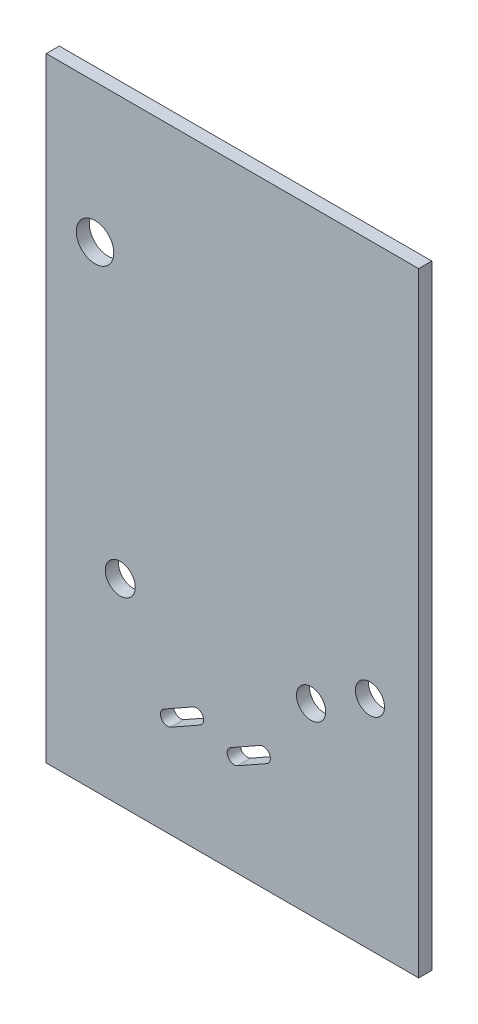
from build123d import *

# Parameters (mm, degrees)
SKETCH1_R           = 3.6
SKETCH1_R_2         = 3.5
SKETCH1_R_3         = 4.5
BOSS_EXTRUDE1_DEPTH = 3.14


with BuildPart() as part:
    # Sketch1 → Boss-Extrude1 (new body)
    # profile 1 of 10: a face of its own
    with BuildSketch(Plane.XY):
        with BuildLine():
            Line((38.651827519, 73.647136153), (-26.230787773, 73.647136153))
            Line((-26.230787773, 73.647136153), (-41.648963672, 73.647136153))
            add(Edge.make_bspline(
                [(-41.648963672, 73.647136153), (-44.643488897, 73.643488897), (-44.647136153, 70.648963672)],
                knots=[3.927599805, 3.927599805, 3.927599805, 5.497178156, 5.497178156, 5.497178156], degree=2, weights=[1, 0.707537269, 1]))
            Line((-44.647136153, 70.648963672), (-44.647136153, -70.648963672))
            add(Edge.make_bspline(
                [(-44.647136153, -70.648963672), (-44.643488897, -73.643488897), (-41.648963672, -73.647136153)],
                knots=[3.927599805, 3.927599805, 3.927599805, 5.497178156, 5.497178156, 5.497178156], degree=2, weights=[1, 0.707537269, 1]))
            Line((-41.648963672, -73.647136153), (27.093393639, -73.647136153))
            add(Edge.make_bspline(
                [(44.647136153, -54.550700861), (44.629350083, -55.622608831), (44.523578432, -56.687840097), (44.215717336, -58.366181711), (44.071515423, -58.983678353), (43.719242041, -60.213836545), (43.51280516, -60.820227412), (42.807525079, -62.600781834), (42.22206304, -63.742215888), (41.337337041, -65.108539745), (41.152542037, -65.37883334), (40.771685792, -65.906986664), (40.57512321, -66.165654002), (39.967232089, -66.92560473), (39.108255703, -67.89614606), (38.152323748, -68.781197278), (37.146406736, -69.622175477), (36.615243643, -70.022491506), (34.981146078, -71.128530207), (33.83112161, -71.747972893), (32.318701378, -72.376617626), (32.012437216, -72.49499434), (31.392225647, -72.716804064), (31.077608459, -72.820394039), (30.133341911, -73.105042114), (29.500121034, -73.261325902), (28.276366882, -73.499851982), (27.686391293, -73.587126278), (27.093393639, -73.647136153)],
                knots=[0.018260035, 0.018260035, 0.018260035, 0.018260035, 0.125, 0.125, 0.1875, 0.1875, 0.25, 0.25, 0.375, 0.375, 0.40625, 0.40625, 0.4375, 0.4375, 0.5, 0.5625, 0.5625, 0.625, 0.625, 0.75, 0.75, 0.78125, 0.78125, 0.8125, 0.8125, 0.875, 0.875, 0.932610516, 0.932610516, 0.932610516, 0.932610516], degree=3))
            Line((44.647136153, -54.550700861), (44.647136153, -53.896039233))
            Line((44.647136153, -53.896039233), (44.647136153, 22.020325098))
            ThreePointArc((44.647136153, 22.020325098), (42.730516554, 17.699527097), (39.139308268, 14.626100819))
            Line((39.139308268, 14.626100819), (39.139308268, 13.683084381))
            ThreePointArc((39.139308268, 13.683084381), (36.430045993, 7.142346655), (29.889308268, 4.433084381))
            Line((29.889308268, 4.433084381), (-36.027217939, 4.433084381))
            ThreePointArc((-36.027217939, 4.433084381), (-37.794984892, 5.165317428), (-38.527217939, 6.933084381))
            Line((-38.527217939, 6.933084381), (-38.527217939, 60.005147218))
            ThreePointArc((-38.527217939, 60.005147218), (-37.794984892, 61.772914171), (-36.027217939, 62.505147218))
            Line((-36.027217939, 62.505147218), (36.639308268, 62.505147218))
            ThreePointArc((36.639308268, 62.505147218), (38.40707522, 61.772914171), (39.139308268, 60.005147218))
            Line((39.139308268, 60.005147218), (39.139308268, 33.556674407))
            ThreePointArc((39.139308268, 33.556674407), (42.730516554, 30.483248128), (44.647136153, 26.162450128))
            Line((44.647136153, 26.162450128), (44.647136153, 67.670503394))
            Line((44.647136153, 67.670503394), (44.647136153, 70.648963672))
            add(Edge.make_bspline(
                [(44.647136153, 70.648963672), (44.643488897, 73.643488897), (41.648963672, 73.647136153)],
                knots=[3.927599805, 3.927599805, 3.927599805, 5.497178156, 5.497178156, 5.497178156], degree=2, weights=[1, 0.707537269, 1]))
            Line((41.648963672, 73.647136153), (38.651827519, 73.647136153))
        make_face()
        with BuildLine():
            ThreePointArc((-14.745996033, -51.265124074), (-17.044884469, -50.621435312), (-16.401195707, -48.322546875))
            Line((-16.401195707, -48.322546875), (-9.42859141, -44.400456958))
            ThreePointArc((-9.42859141, -44.400456958), (-7.129702973, -45.04414572), (-7.773391736, -47.343034157))
            Line((-7.773391736, -47.343034157), (-14.745996033, -51.265124074))
        make_face(mode=Mode.SUBTRACT)
        with Locations((-26.900831216, -26.517202566)):
            Circle(SKETCH1_R, mode=Mode.SUBTRACT)
        with BuildLine():
            ThreePointArc((1.254003967, -51.265124074), (-1.044884469, -50.621435312), (-0.401195707, -48.322546875))
            Line((-0.401195707, -48.322546875), (6.57140859, -44.400456958))
            ThreePointArc((6.57140859, -44.400456958), (8.870297027, -45.04414572), (8.226608264, -47.343034157))
            Line((8.226608264, -47.343034157), (1.254003967, -51.265124074))
        make_face(mode=Mode.SUBTRACT)
        with Locations((18.849494268, -29.546234455)):
            Circle(SKETCH1_R_2, mode=Mode.SUBTRACT)
        with Locations((32.960239, -21.476652312)):
            Circle(SKETCH1_R_2, mode=Mode.SUBTRACT)
    # profile 2 of 10: a face of its own
    with BuildSketch(Plane.XY):
        with BuildLine():
            add(Edge.make_bspline(
                [(-41.648963672, 73.647136153), (-44.643488897, 73.643488897), (-44.647136153, 70.648963672)],
                knots=[3.927599805, 3.927599805, 3.927599805, 5.497178156, 5.497178156, 5.497178156], degree=2, weights=[1, 0.707537269, 1]))
            Line((-41.648963672, 73.647136153), (-44.647136153, 73.647136153))
            Line((-44.647136153, 73.647136153), (-44.647136153, 70.648963672))
        make_face()
    # profile 3 of 10: a face of its own
    with BuildSketch(Plane.XY):
        with BuildLine():
            Line((44.647136153, 73.647136153), (41.648963672, 73.647136153))
            add(Edge.make_bspline(
                [(44.647136153, 70.648963672), (44.643488897, 73.643488897), (41.648963672, 73.647136153)],
                knots=[3.927599805, 3.927599805, 3.927599805, 5.497178156, 5.497178156, 5.497178156], degree=2, weights=[1, 0.707537269, 1]))
            Line((44.647136153, 70.648963672), (44.647136153, 73.647136153))
        make_face()
    # profile 4 of 10: a face of its own
    with BuildSketch(Plane.XY):
        with BuildLine():
            add(Edge.make_bspline(
                [(-44.647136153, -70.648963672), (-44.643488897, -73.643488897), (-41.648963672, -73.647136153)],
                knots=[3.927599805, 3.927599805, 3.927599805, 5.497178156, 5.497178156, 5.497178156], degree=2, weights=[1, 0.707537269, 1]))
            Line((-44.647136153, -70.648963672), (-44.647136153, -73.647136153))
            Line((-44.647136153, -73.647136153), (-41.648963672, -73.647136153))
        make_face()
    # profile 5 of 10: a face of its own
    with BuildSketch(Plane.XY):
        with BuildLine():
            Line((44.647136153, 22.020325098), (44.647136153, 26.162450128))
            ThreePointArc((44.647136153, 26.162450128), (42.730516554, 30.483248128), (39.139308268, 33.556674407))
            Line((39.139308268, 33.556674407), (39.139308268, 14.626100819))
            ThreePointArc((39.139308268, 14.626100819), (42.730516554, 17.699527097), (44.647136153, 22.020325098))
        make_face()
    # profile 6 of 10: a face of its own
    with BuildSketch(Plane.XY):
        with BuildLine():
            add(Edge.make_bspline(
                [(44.647136153, -54.550700861), (44.629350083, -55.622608831), (44.523578432, -56.687840097), (44.215717336, -58.366181711), (44.071515423, -58.983678353), (43.719242041, -60.213836545), (43.51280516, -60.820227412), (42.807525079, -62.600781834), (42.22206304, -63.742215888), (41.337337041, -65.108539745), (41.152542037, -65.37883334), (40.771685792, -65.906986664), (40.57512321, -66.165654002), (39.967232089, -66.92560473), (39.108255703, -67.89614606), (38.152323748, -68.781197278), (37.146406736, -69.622175477), (36.615243643, -70.022491506), (34.981146078, -71.128530207), (33.83112161, -71.747972893), (32.318701378, -72.376617626), (32.012437216, -72.49499434), (31.392225647, -72.716804064), (31.077608459, -72.820394039), (30.133341911, -73.105042114), (29.500121034, -73.261325902), (28.276366882, -73.499851982), (27.686391293, -73.587126278), (27.093393639, -73.647136153)],
                knots=[0.018260035, 0.018260035, 0.018260035, 0.018260035, 0.125, 0.125, 0.1875, 0.1875, 0.25, 0.25, 0.375, 0.375, 0.40625, 0.40625, 0.4375, 0.4375, 0.5, 0.5625, 0.5625, 0.625, 0.625, 0.75, 0.75, 0.78125, 0.78125, 0.8125, 0.8125, 0.875, 0.875, 0.932610516, 0.932610516, 0.932610516, 0.932610516], degree=3))
            Line((27.093393639, -73.647136153), (44.647136153, -73.647136153))
            Line((44.647136153, -73.647136153), (44.647136153, -54.550700861))
        make_face()
    # profile 7 of 10: a face of its own
    with BuildSketch(Plane.XY):
        with BuildLine():
            ThreePointArc((24.922228065, 29.508743732), (31.21939997, 34.382384037), (39.139308268, 33.556674407))
            Line((39.139308268, 33.556674407), (39.139308268, 60.005147218))
            ThreePointArc((39.139308268, 60.005147218), (38.40707522, 61.772914171), (36.639308268, 62.505147218))
            Line((36.639308268, 62.505147218), (-36.027217939, 62.505147218))
            ThreePointArc((-36.027217939, 62.505147218), (-37.794984892, 61.772914171), (-38.527217939, 60.005147218))
            Line((-38.527217939, 60.005147218), (-38.527217939, 6.933084381))
            ThreePointArc((-38.527217939, 6.933084381), (-37.794984892, 5.165317428), (-36.027217939, 4.433084381))
            Line((-36.027217939, 4.433084381), (29.889308268, 4.433084381))
            ThreePointArc((29.889308268, 4.433084381), (36.430045993, 7.142346655), (39.139308268, 13.683084381))
            Line((39.139308268, 13.683084381), (39.139308268, 14.626100819))
            ThreePointArc((39.139308268, 14.626100819), (31.21939997, 13.800391189), (24.922228065, 18.674031494))
            Line((24.922228065, 18.674031494), (24.922228065, 10.28797778))
            Line((24.922228065, 10.28797778), (-25.167870173, 10.28797778))
            Line((-25.167870173, 10.28797778), (-25.167870173, 56.21628744))
            Line((-25.167870173, 56.21628744), (24.922228065, 56.21628744))
            Line((24.922228065, 56.21628744), (24.922228065, 29.508743732))
        make_face()
        with Locations((-32.953932198, 40.341063425)):
            Circle(SKETCH1_R_3, mode=Mode.SUBTRACT)
    # profile 8 of 10: a face of its own
    with BuildSketch(Plane.XY):
        with BuildLine():
            Line((39.139308268, 14.626100819), (39.139308268, 33.556674407))
            ThreePointArc((39.139308268, 33.556674407), (31.21939997, 34.382384037), (24.922228065, 29.508743732))
            Line((24.922228065, 29.508743732), (24.922228065, 18.674031494))
            ThreePointArc((24.922228065, 18.674031494), (31.21939997, 13.800391189), (39.139308268, 14.626100819))
        make_face()
    # profile 9 of 10: a face of its own
    with BuildSketch(Plane.XY):
        with BuildLine():
            ThreePointArc((24.922228065, 18.674031494), (23.449484032, 24.091387613), (24.922228065, 29.508743732))
            Line((24.922228065, 29.508743732), (24.922228065, 56.21628744))
            Line((24.922228065, 56.21628744), (-25.167870173, 56.21628744))
            Line((-25.167870173, 56.21628744), (-25.167870173, 10.28797778))
            Line((-25.167870173, 10.28797778), (24.922228065, 10.28797778))
            Line((24.922228065, 10.28797778), (24.922228065, 18.674031494))
        make_face()
    # profile 10 of 10: a face of its own
    with BuildSketch(Plane.XY):
        with BuildLine():
            Line((24.922228065, 18.674031494), (24.922228065, 29.508743732))
            ThreePointArc((24.922228065, 29.508743732), (23.449484032, 24.091387613), (24.922228065, 18.674031494))
        make_face()
    extrude(amount=BOSS_EXTRUDE1_DEPTH)


solid = part.part
